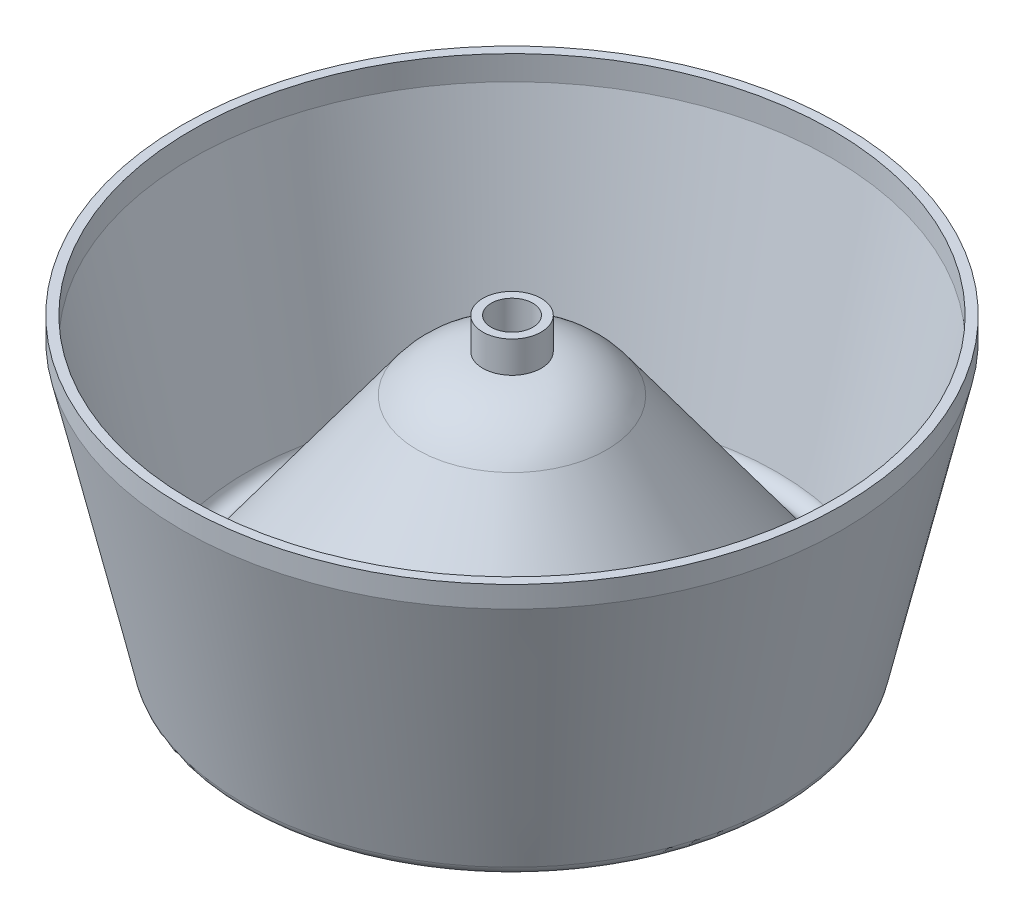
from build123d import *


with BuildPart() as part:
    # Sketch1 → Revolve7 (revolve)
    with BuildSketch(Plane(origin=(0, 0, 0), x_dir=(0, 0, -1), z_dir=(1, 0, 0))):
        with BuildLine():
            Line((-59.148631637, -32.404719831), (-21.068373541, 19.926718309))
            ThreePointArc((-21.068373541, 19.926718309), (-14.017788653, 26.011562826), (-5, 28.338700093))
            Line((-5, 28.338700093), (-5, 37.743055381))
            Line((-5, 37.743055381), (-7, 37.743055381))
            Line((-7, 37.743055381), (-7, 30.208100681))
            ThreePointArc((-7, 30.208100681), (-15.803114649, 27.310289813), (-22.685536518, 21.103486724))
            Line((-22.685536518, 21.103486724), (-58.176080505, -27.669061048))
            ThreePointArc((-58.176080505, -27.669061048), (-61.205332633, -28.842577937), (-63.526904277, -26.570174926))
            Line((-63.526904277, -26.570174926), (-76.841870349, 31.885910778))
            Line((-76.841870349, 31.885910778), (-76.841870349, 37.743055381))
            Line((-76.841870349, 37.743055381), (-79.058926618, 37.743055381))
            Line((-79.058926618, 37.743055381), (-79.058926618, 32.613945898))
            Line((-79.058926618, 32.613945898), (-64.499455409, -31.305833709))
            ThreePointArc((-64.499455409, -31.305833709), (-62.177883765, -33.578236719), (-59.148631637, -32.404719831))
        make_face()
    revolve(axis=Axis((0, 0, 0), (0, -1, 0)))


solid = part.part
